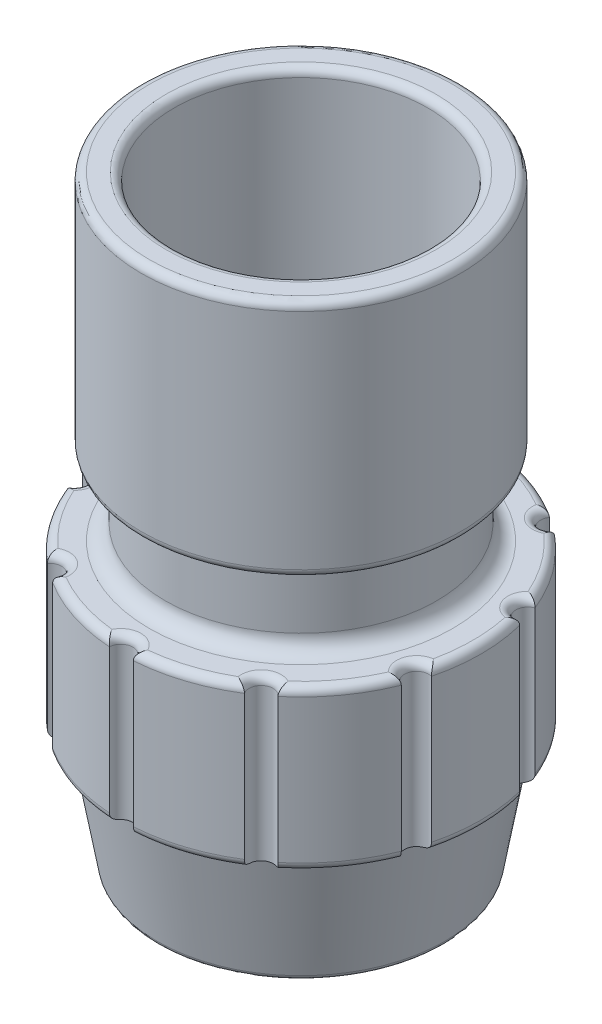
from build123d import *

# Parameters (mm, degrees)
SKETCH_1_R               = 17.9
SKETCH_1_R_2             = 16
EXTRUDE_1_DEPTH          = 15
EXTRUDE_1_DRAFT          = -10
SKETCH_2_R               = 22.544904711
EXTRUDE_1_2_DEPTH        = 20
FILLET_1_R               = 0.7
FILLET_2_R               = 1
SKETCH_3_R               = 1.5
CUT_EXTRUDE_1_DEPTH      = 48.344962317
PATTERN_CIRCULAR_1_COUNT = 10
SKETCH_4_R               = 17
EXTRUDE_2_DEPTH          = 10
FILLET_3_R               = 2
SKETCH_5_R               = 20
EXTRUDE_3_DEPTH          = 30
SKETCH_6_R               = 15.885
CUT_EXTRUDE_2_DEPTH      = 82.481887287
FILLET_4_R               = 1
FILLET_5_R               = 1
FILLET_6_R               = 1


with BuildPart() as part:
    # Эскиз1 → Extrude 1 (with draft: the straight prism first)
    with BuildSketch(Plane(origin=(0, 0, 0), x_dir=(1, 0, 0), z_dir=(0, 1, 0))):
        Circle(SKETCH_1_R)
        Circle(SKETCH_1_R_2, mode=Mode.SUBTRACT)
    extrude(amount=EXTRUDE_1_DEPTH)
    # Extrude 1: the draft: its side faces are tilted about the plane it starts from
    extrude_1_sides = [part.faces().sort_by_distance(p)[0] for p in [
        (-17.9, 7.5, 0),
        (-16, 7.5, 0),
    ]]
    draft(extrude_1_sides, Plane(origin=(0, 0, 0), x_dir=(1, 0, 0), z_dir=(0, 1, 0)), EXTRUDE_1_DRAFT)

    # Эскиз2 → Extrude 1 2 (add)
    with BuildSketch(Plane(origin=(0, 15, 0), x_dir=(1, 0, 0), z_dir=(0, 1, 0))):
        Circle(SKETCH_2_R)
    extrude(amount=EXTRUDE_1_2_DEPTH)

    # Скругление1
    fillet_1_edges = [part.edges().sort_by_distance(p)[0] for p in [
        (-16, 0, 0),
        (-17.9, 0, 0),
    ]]
    fillet(fillet_1_edges, radius=FILLET_1_R)

    # Скругление2
    fillet_2_edges = [part.edges().sort_by_distance(p)[0] for p in [
        (-22.544904711, 15, 0),
    ]]
    fillet(fillet_2_edges, radius=FILLET_2_R)

    # Эскиз3 → Вырез-Вытянуть1 (cut, through all)
    with BuildSketch(Plane(origin=(0, 35, 0), x_dir=(1, 0, 0), z_dir=(0, 1, 0))):
        with Locations((0, 22.544904711)):
            Circle(SKETCH_3_R)
    cut_extrude_1 = extrude(amount=-CUT_EXTRUDE_1_DEPTH, mode=Mode.SUBTRACT)

    # Круговой массив1: Вырез-Вытянуть1 ×10 about axis
    pattern_circular_1_axis = Axis((0, 35, 0), (0, -1, 0))
    for i in range(1, PATTERN_CIRCULAR_1_COUNT):
        add(cut_extrude_1.rotate(pattern_circular_1_axis, i * 360 / PATTERN_CIRCULAR_1_COUNT), mode=Mode.SUBTRACT)

    # Эскиз4 → Бобышка-Вытянуть2 (add)
    with BuildSketch(Plane(origin=(0, 35, 0), x_dir=(1, 0, 0), z_dir=(0, 1, 0))):
        Circle(SKETCH_4_R)
    extrude(amount=EXTRUDE_2_DEPTH)

    # Скругление3
    fillet_3_edges = [part.edges().sort_by_distance(p)[0] for p in [
        (-17, 35, 0),
    ]]
    fillet(fillet_3_edges, radius=FILLET_3_R)

    # Эскиз5 → Бобышка-Вытянуть3 (add)
    with BuildSketch(Plane(origin=(0, 45, 0), x_dir=(1, 0, 0), z_dir=(0, 1, 0))):
        Circle(SKETCH_5_R)
    extrude(amount=EXTRUDE_3_DEPTH)

    # Эскиз6 → Вырез-Вытянуть2 (cut, through all)
    with BuildSketch(Plane(origin=(0, 75, 0), x_dir=(1, 0, 0), z_dir=(0, 1, 0))):
        Circle(SKETCH_6_R)
    extrude(amount=-CUT_EXTRUDE_2_DEPTH, mode=Mode.SUBTRACT)

    # Скругление4
    fillet_4_edges = [part.edges().sort_by_distance(p)[0] for p in [
        (-20, 45, 0),
    ]]
    fillet(fillet_4_edges, radius=FILLET_4_R)

    # Скругление5
    fillet_5_edges = [part.edges().sort_by_distance(p)[0] for p in [
        (-20, 75, 0),
        (-15.885, 75, 0),
    ]]
    fillet(fillet_5_edges, radius=FILLET_5_R)

    # Скругление6
    fillet_6_edges = [part.edges().sort_by_distance(p)[0] for p in [
        (-6.966758692, 35, -21.441478534),
        (0, 35, -21.044904711),
        (6.966758692, 35, -21.441478534),
        (12.369884625, 35, -17.025685556),
        (18.239211047, 35, -13.251562503),
        (20.01489376, 35, -6.503233201),
        (22.544904711, 35, 0),
        (20.01489376, 35, 6.503233201),
        (18.239211047, 35, 13.251562503),
        (12.369884625, 35, 17.025685556),
        (6.966758692, 35, 21.441478534),
        (0, 35, 21.044904711),
        (-6.966758692, 35, 21.441478534),
        (-12.369884625, 35, 17.025685556),
        (-18.239211047, 35, 13.251562503),
        (-20.01489376, 35, 6.503233201),
        (-22.544904711, 35, 0),
        (-20.01489376, 35, -6.503233201),
        (-18.239211047, 35, -13.251562503),
        (-12.369884625, 35, -17.025685556),
    ]]
    fillet(fillet_6_edges, radius=FILLET_6_R)


solid = part.part
